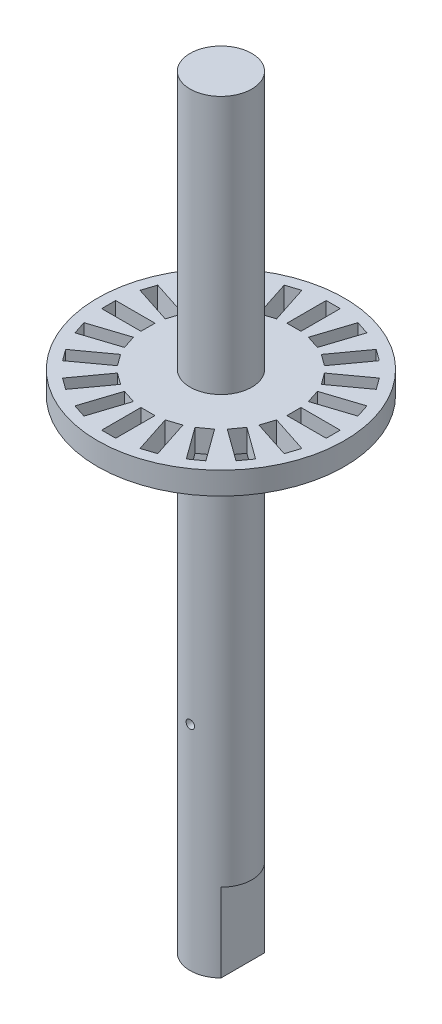
from build123d import *
from build123d.topology import SkipClean

# Parameters (mm, degrees)
SKETCH_1_R          = 2.75
EXTRUDE_1_DEPTH     = 61
EXTRUDE_START       = 7
EXTRUDE_2_DEPTH     = 7
SKETCH_4_R          = 0.375
CUT_EXTRUDE_1_DEPTH = 5
EXTRUDE_START_2     = -25
SKETCH_6_R          = 11
SKETCH_6_W          = 1.25
SKETCH_6_H          = 3.5
SKETCH_6_W_2        = 3.5
SKETCH_6_H_2        = 1.25
EXTRUDE_4_DEPTH     = 2


with BuildPart() as part:
    # 草图1 → 凸台-拉伸1 (new body)
    with BuildSketch(Plane(origin=(0, 0, 0), x_dir=(1, 0, 0), z_dir=(0, 1, 0))):
        Circle(SKETCH_1_R)
    extrude(amount=EXTRUDE_1_DEPTH)

    # 草图2 → 凸台-拉伸2 (add)
    with SkipClean():  # the faces are left unmerged after this step: merging them gives an invalid solid
        with BuildSketch(Plane.XZ.offset(EXTRUDE_START)):
            with BuildLine():
                Line((-1.95, 1.939071943), (-1.95, -1.939071943))
                ThreePointArc((-1.95, -1.939071943), (0, -2.75), (1.95, -1.939071943))
                Line((1.95, -1.939071943), (1.95, 1.939071943))
                ThreePointArc((1.95, 1.939071943), (0, 2.75), (-1.95, 1.939071943))
            make_face()
        extrude(amount=-EXTRUDE_2_DEPTH)

    # 草图4 → 切除-拉伸1 (cut, symmetric)
    with SkipClean():  # the faces are left unmerged after this step: merging them gives an invalid solid
        with BuildSketch(Plane.XY):
            with Locations((0, 12)):
                Circle(SKETCH_4_R)
        extrude(amount=CUT_EXTRUDE_1_DEPTH, both=True, mode=Mode.SUBTRACT)

    # 草图6 → 凸台-拉伸4 (add)
    with SkipClean():  # the faces are left unmerged after this step: merging them gives an invalid solid
        with BuildSketch(Plane(origin=(0, 61, 0), x_dir=(1, 0, 0), z_dir=(0, 1, 0)).offset(EXTRUDE_START_2)):
            Circle(SKETCH_6_R)
            Polygon((2.495759621, 9.703700784), (3.684580266, 9.317429541), (2.603020786, 5.988731734), (1.414200141, 6.375002977), align=None, mode=Mode.SUBTRACT)
            with Locations((0, 8.25)):
                Rectangle(SKETCH_6_W, SKETCH_6_H, mode=Mode.SUBTRACT)
            Polygon((5.372216901, 8.457535726), (6.383488144, 7.722804161), (4.326239761, 4.891244681), (3.314968518, 5.625976246), align=None, mode=Mode.SUBTRACT)
            Polygon((7.722804161, 6.383488144), (8.457535726, 5.372216901), (5.625976246, 3.314968518), (4.891244681, 4.326239761), align=None, mode=Mode.SUBTRACT)
            Polygon((9.317429541, 3.684580266), (9.703700784, 2.495759621), (6.375002977, 1.414200141), (5.988731734, 2.603020786), align=None, mode=Mode.SUBTRACT)
            with Locations((8.25, 0)):
                Rectangle(SKETCH_6_W_2, SKETCH_6_H_2, mode=Mode.SUBTRACT)
            Polygon((9.703700784, -2.495759621), (9.317429541, -3.684580266), (5.988731734, -2.603020786), (6.375002977, -1.414200141), align=None, mode=Mode.SUBTRACT)
            Polygon((8.457535726, -5.372216901), (7.722804161, -6.383488144), (4.891244681, -4.326239761), (5.625976246, -3.314968518), align=None, mode=Mode.SUBTRACT)
            Polygon((6.383488144, -7.722804161), (5.372216901, -8.457535726), (3.314968518, -5.625976246), (4.326239761, -4.891244681), align=None, mode=Mode.SUBTRACT)
            Polygon((3.684580266, -9.317429541), (2.495759621, -9.703700784), (1.414200141, -6.375002977), (2.603020786, -5.988731734), align=None, mode=Mode.SUBTRACT)
            with Locations((0, -8.25)):
                Rectangle(SKETCH_6_W, SKETCH_6_H, mode=Mode.SUBTRACT)
            Polygon((-2.495759621, -9.703700784), (-3.684580266, -9.317429541), (-2.603020786, -5.988731734), (-1.414200141, -6.375002977), align=None, mode=Mode.SUBTRACT)
            Polygon((-5.372216901, -8.457535726), (-6.383488144, -7.722804161), (-4.326239761, -4.891244681), (-3.314968518, -5.625976246), align=None, mode=Mode.SUBTRACT)
            Polygon((-7.722804161, -6.383488144), (-8.457535726, -5.372216901), (-5.625976246, -3.314968518), (-4.891244681, -4.326239761), align=None, mode=Mode.SUBTRACT)
            Polygon((-9.317429541, -3.684580266), (-9.703700784, -2.495759621), (-6.375002977, -1.414200141), (-5.988731734, -2.603020786), align=None, mode=Mode.SUBTRACT)
            with Locations((-8.25, 0)):
                Rectangle(SKETCH_6_W_2, SKETCH_6_H_2, mode=Mode.SUBTRACT)
            Polygon((-9.703700784, 2.495759621), (-9.317429541, 3.684580266), (-5.988731734, 2.603020786), (-6.375002977, 1.414200141), align=None, mode=Mode.SUBTRACT)
            Polygon((-8.457535726, 5.372216901), (-7.722804161, 6.383488144), (-4.891244681, 4.326239761), (-5.625976246, 3.314968518), align=None, mode=Mode.SUBTRACT)
            Polygon((-6.383488144, 7.722804161), (-5.372216901, 8.457535726), (-3.314968518, 5.625976246), (-4.326239761, 4.891244681), align=None, mode=Mode.SUBTRACT)
            Polygon((-3.684580266, 9.317429541), (-2.495759621, 9.703700784), (-1.414200141, 6.375002977), (-2.603020786, 5.988731734), align=None, mode=Mode.SUBTRACT)
        extrude(amount=EXTRUDE_4_DEPTH)


solid = part.part
